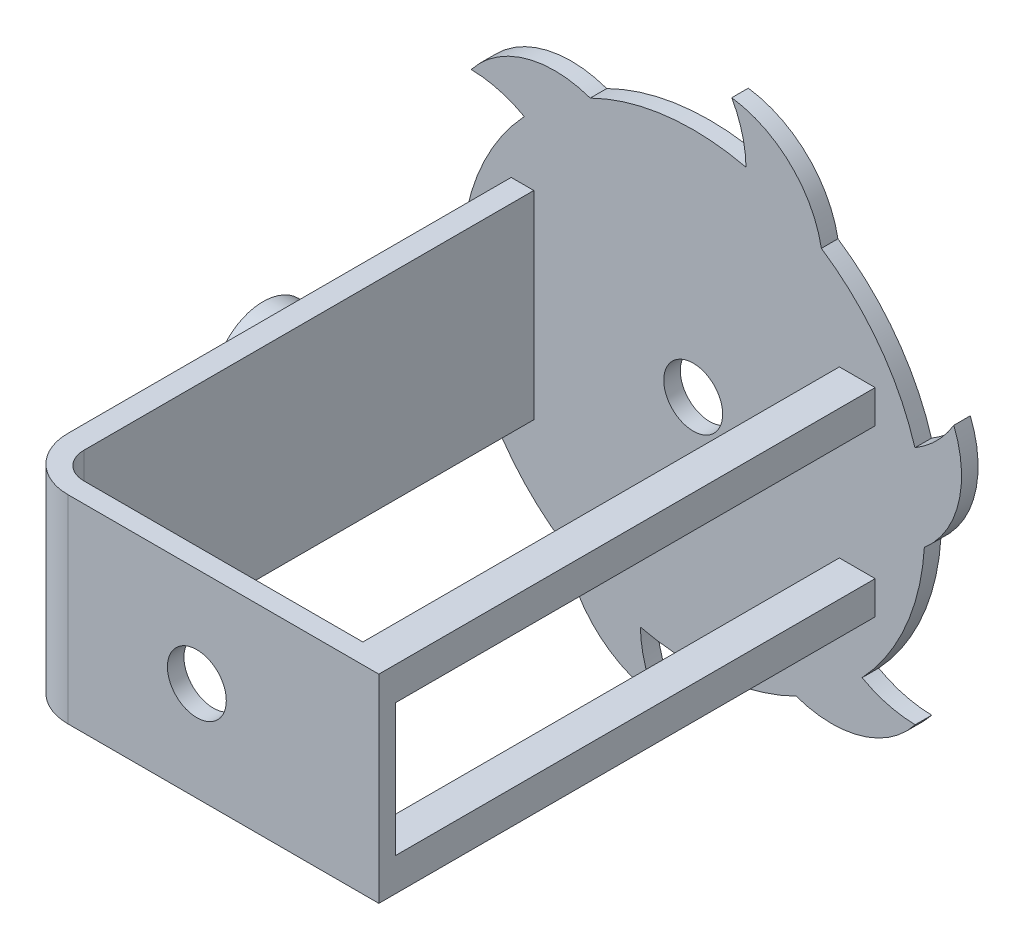
from build123d import *

# Parameters (mm, degrees)
SKETCH1_R           = 35
BOSS_EXTRUDE1_DEPTH = 2.5
SKETCH11_R          = 4.45
CUT_EXTRUDE5_DEPTH  = 10
BOSS_EXTRUDE4_START = 75
SKETCH5_W           = 55
SKETCH5_H           = 30
SKETCH5_R           = 4.45
BOSS_EXTRUDE4_DEPTH = 75
SKETCH6_W           = 72.5
SKETCH6_H           = 20
CUT_EXTRUDE2_DEPTH  = 45
SKETCH7_R           = 7.5
BOSS_EXTRUDE5_DEPTH = 10
CUT_EXTRUDE3_DEPTH  = 30
FILLET1_R           = 8


with BuildPart() as part:
    # Sketch1 → Boss-Extrude1 (new body)
    with BuildSketch(Plane.XY):
        with BuildLine():
            ThreePointArc((-33.502769568, -10.1274099), (-34.767453022, -4.027928789), (-34.930842804, 2.199140974))
            ThreePointArc((-34.930842804, 2.199140974), (-40.093982991, -6.182304711), (-39.373214245, -16))
            ThreePointArc((-39.373214245, -16), (-36.802059341, -12.69977052), (-33.502769568, -10.1274099))
        make_face()
        Circle(SKETCH1_R)
        with BuildLine():
            ThreePointArc((-25.521979032, 23.950544593), (-20.872015167, 28.095533148), (-15.560909452, 31.350567731))
            ThreePointArc((-15.560909452, 31.350567731), (-25.401024429, 31.631255454), (-33.543013583, 26.098203765))
            ThreePointArc((-33.543013583, 26.098203765), (-29.399353563, 25.521633041), (-25.521979032, 23.950544593))
        make_face()
        with BuildLine():
            ThreePointArc((7.980790536, 34.077954493), (13.895437855, 32.123461937), (19.369933352, 29.151426756))
            ThreePointArc((19.369933352, 29.151426756), (14.692958562, 37.813560165), (5.830200662, 42.098203765))
            ThreePointArc((5.830200662, 42.098203765), (7.402705778, 38.221403561), (7.980790536, 34.077954493))
        make_face()
        with BuildLine():
            ThreePointArc((34.930842804, -2.199140974), (40.093982991, 6.182304711), (39.373214245, 16))
            ThreePointArc((39.373214245, 16), (36.802059341, 12.69977052), (33.502769568, 10.1274099))
            ThreePointArc((33.502769568, 10.1274099), (34.623669179, 5.11874326), (35, 0))
            ThreePointArc((35, 0), (34.982706429, -1.100114056), (34.930842804, -2.199140974))
        make_face()
        with BuildLine():
            ThreePointArc((33.543013583, -26.098203765), (29.399353563, -25.521633041), (25.521979032, -23.950544593))
            ThreePointArc((25.521979032, -23.950544593), (20.872015167, -28.095533148), (15.560909452, -31.350567731))
            ThreePointArc((15.560909452, -31.350567731), (25.401024429, -31.631255454), (33.543013583, -26.098203765))
        make_face()
        with BuildLine():
            ThreePointArc((-5.830200662, -42.098203765), (-7.402705778, -38.221403561), (-7.980790536, -34.077954493))
            ThreePointArc((-7.980790536, -34.077954493), (-13.895437855, -32.123461937), (-19.369933352, -29.151426756))
            ThreePointArc((-19.369933352, -29.151426756), (-14.692958562, -37.813560165), (-5.830200662, -42.098203765))
        make_face()
    extrude(amount=BOSS_EXTRUDE1_DEPTH)

    # Sketch11 → Cut-Extrude5 (cut)
    with BuildSketch(Plane.XY.offset(2.5)):
        Circle(SKETCH11_R)
    extrude(amount=-CUT_EXTRUDE5_DEPTH, mode=Mode.SUBTRACT)

    # Sketch5 → Boss-Extrude4 (add)
    with BuildSketch(Plane.XY.offset(2.5).offset(BOSS_EXTRUDE4_START)):
        Rectangle(SKETCH5_W, SKETCH5_H)
        Circle(SKETCH5_R, mode=Mode.SUBTRACT)
    extrude(amount=-BOSS_EXTRUDE4_DEPTH)

    # Sketch6 → Cut-Extrude2 (cut)
    with BuildSketch(Plane(origin=(27.5, 0, 0), x_dir=(0, 0, -1), z_dir=(1, 0, 0))):
        with Locations((-38.75, 0)):
            Rectangle(SKETCH6_W, SKETCH6_H)
    extrude(amount=-CUT_EXTRUDE2_DEPTH, mode=Mode.SUBTRACT)

    # Sketch7 → Boss-Extrude5 (add)
    with BuildSketch(Plane.ZY.offset(27.5)):
        with Locations(Location((30, 0, 0), (0, 0, 270))):
            Circle(SKETCH7_R)
    extrude(amount=BOSS_EXTRUDE5_DEPTH)

    # Sketch8 → Cut-Extrude3 (cut)
    with BuildSketch(Plane.XZ.offset(15)):
        with BuildLine():
            Line((-24.082664687, 70.5), (-24.082664687, 2.5))
            Line((-24.082664687, 2.5), (22.085730974, 2.5))
            Line((22.085730974, 2.5), (22.085730974, 74.5))
            Line((22.085730974, 74.5), (-20.082664687, 74.5))
            ThreePointArc((-20.082664687, 74.5), (-22.911091812, 73.328427125), (-24.082664687, 70.5))
        make_face()
    extrude(amount=-CUT_EXTRUDE3_DEPTH, mode=Mode.SUBTRACT)

    # Fillet1
    fillet1_edges = [part.edges().sort_by_distance(p)[0] for p in [
        (-27.5, 0, 77.5),
    ]]
    fillet(fillet1_edges, radius=FILLET1_R)


solid = part.part
